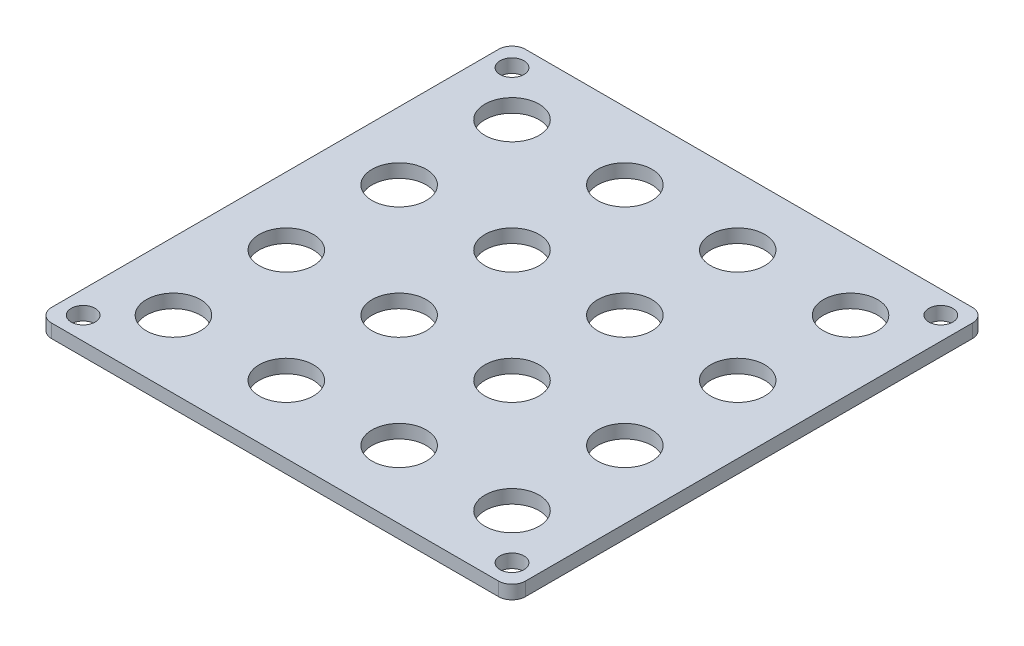
from build123d import *

# Parameters (mm, degrees)
SKETCH1_W            = 105
SKETCH1_H            = 105
SKETCH1_R            = 6
BOSS_EXTRUDE1_DEPTH  = 3
M5_CLEARANCE_HOLE1_D = 5.3
FILLET2_R            = 3


with BuildPart() as part:
    # Sketch1 → Boss-Extrude1 (new body)
    with BuildSketch(Plane(origin=(0, 0, 0), x_dir=(1, 0, 0), z_dir=(0, 1, 0))):
        with Locations((37.5, -37.5)):
            Rectangle(SKETCH1_W, SKETCH1_H)
        with Locations(Location((0, 0, 0), (0, 0, 270))):
            Circle(SKETCH1_R, mode=Mode.SUBTRACT)
        with Locations(Location((25, 0, 0), (0, 0, 270))):
            Circle(SKETCH1_R, mode=Mode.SUBTRACT)
        with Locations(Location((50, 0, 0), (0, 0, 270))):
            Circle(SKETCH1_R, mode=Mode.SUBTRACT)
        with Locations(Location((75, 0, 0), (0, 0, 270))):
            Circle(SKETCH1_R, mode=Mode.SUBTRACT)
        with Locations(Location((25, -25, 0), (0, 0, 270))):
            Circle(SKETCH1_R, mode=Mode.SUBTRACT)
        with Locations(Location((50, -25, 0), (0, 0, 270))):
            Circle(SKETCH1_R, mode=Mode.SUBTRACT)
        with Locations(Location((75, -25, 0), (0, 0, 270))):
            Circle(SKETCH1_R, mode=Mode.SUBTRACT)
        with Locations(Location((25, -50, 0), (0, 0, 270))):
            Circle(SKETCH1_R, mode=Mode.SUBTRACT)
        with Locations(Location((50, -50, 0), (0, 0, 270))):
            Circle(SKETCH1_R, mode=Mode.SUBTRACT)
        with Locations(Location((75, -50, 0), (0, 0, 270))):
            Circle(SKETCH1_R, mode=Mode.SUBTRACT)
        with Locations(Location((0, -25, 0), (0, 0, 270))):
            Circle(SKETCH1_R, mode=Mode.SUBTRACT)
        with Locations(Location((0, -50, 0), (0, 0, 270))):
            Circle(SKETCH1_R, mode=Mode.SUBTRACT)
        with Locations(Location((0, -75, 0), (0, 0, 270))):
            Circle(SKETCH1_R, mode=Mode.SUBTRACT)
        with Locations(Location((75, -75, 0), (0, 0, 270))):
            Circle(SKETCH1_R, mode=Mode.SUBTRACT)
        with Locations(Location((25, -75, 0), (0, 0, 270))):
            Circle(SKETCH1_R, mode=Mode.SUBTRACT)
        with Locations(Location((50, -75, 0), (0, 0, 270))):
            Circle(SKETCH1_R, mode=Mode.SUBTRACT)
    extrude(amount=BOSS_EXTRUDE1_DEPTH)

    # M5 Clearance Hole1 (through all)
    with Locations(Plane(origin=(0, 3, 0), x_dir=(1, 0, 0), z_dir=(0, 1, 0))):
        with Locations((-10, 10), (-10, -85), (85, -85), (85, 10)):
            Hole(M5_CLEARANCE_HOLE1_D / 2)

    # Fillet2
    fillet2_edges = [part.edges().sort_by_distance(p)[0] for p in [
        (-15, 1.5, -15),
        (90, 1.5, -15),
        (90, 1.5, 90),
        (-15, 1.5, 90),
    ]]
    fillet(fillet2_edges, radius=FILLET2_R)


solid = part.part
